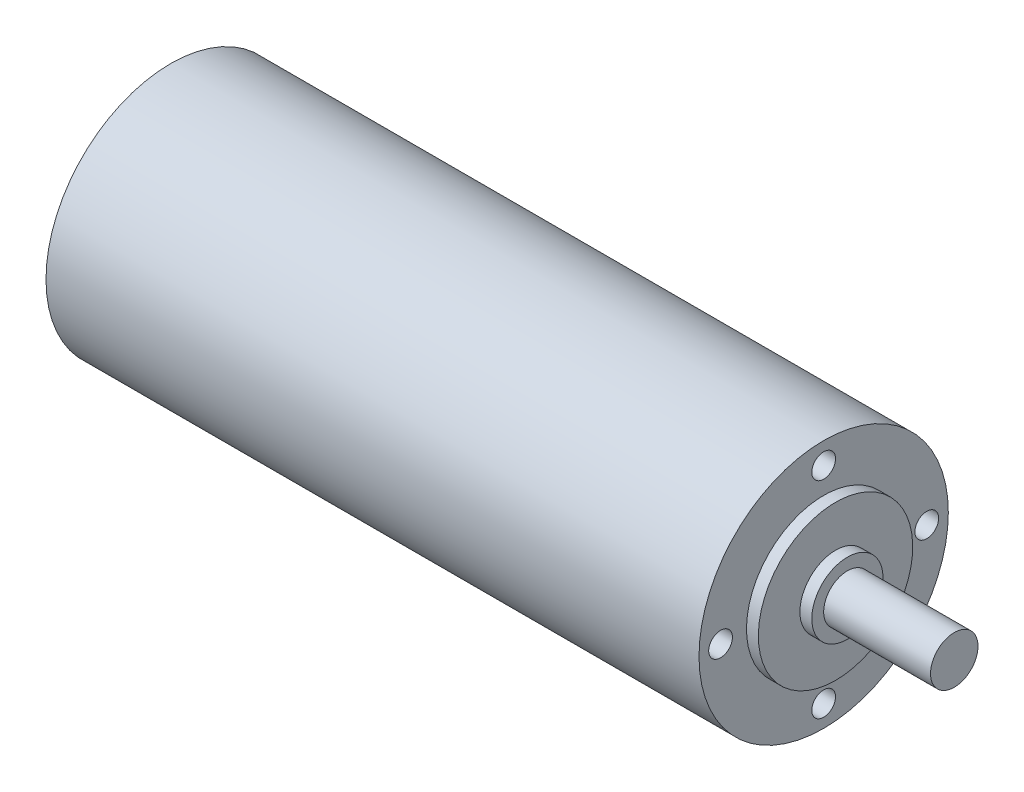
from build123d import *

# Parameters (mm, degrees)
SKETCH2_R          = 2
CUT_EXTRUDE1_DEPTH = 10


with BuildPart() as part:
    # Sketch1 → Revolve1 (revolve)
    with BuildSketch(Plane.XY, mode=Mode.PRIVATE) as revolve1_sk:
        Polygon((0, 0), (132, 0), (132, 4), (114, 4), (114, 6), (112, 6), (112, 13), (110, 13), (110, 21), (0, 21), align=None)
    revolve(revolve1_sk.sketch.rotate(Axis((0, 0, 0), (1, 0, 0)), 180), axis=Axis((0, 0, 0), (1, 0, 0)))

    # Sketch2 → Cut-Extrude1 (cut)
    with BuildSketch(Plane(origin=(110, 0, 0), x_dir=(0, 0, -1), z_dir=(1, 0, 0))):
        with Locations(Location((0, 17.365813997, 0), (0, 0, 90))):
            Circle(SKETCH2_R)
        with Locations(Location((17.365813997, 0, 0), (0, 0, 90))):
            Circle(SKETCH2_R)
        with Locations(Location((0, -17.365813997, 0), (0, 0, 90))):
            Circle(SKETCH2_R)
        with Locations(Location((-17.365813997, 0, 0), (0, 0, 90))):
            Circle(SKETCH2_R)
    extrude(amount=-CUT_EXTRUDE1_DEPTH, mode=Mode.SUBTRACT)


solid = part.part
